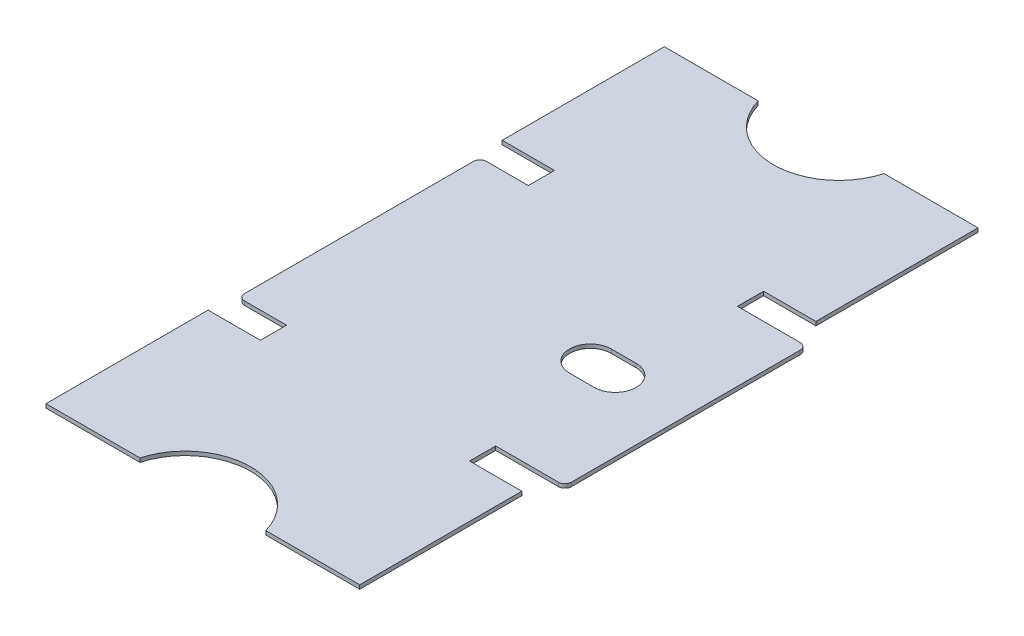
from build123d import *

# Parameters (mm, degrees)
EXTRUDE_1_DEPTH = 0.3


with BuildPart() as part:
    # Эскиз1 → Бобышка-Вытянуть1 (new body)
    with BuildSketch(Plane(origin=(0, 0, 0), x_dir=(1, 0, 0), z_dir=(0, 1, 0))):
        with BuildLine():
            Line((-11.404541059, 16.350155755), (-11.404541059, 28.750155755))
            Line((-11.404541059, 28.750155755), (-18.590239448, 28.750155755))
            ThreePointArc((-18.590239448, 28.750155755), (-23.404541059, 25.100155755), (-28.218842669, 28.750155755))
            Line((-28.218842669, 28.750155755), (-35.404541059, 28.750155755))
            Line((-35.404541059, 28.750155755), (-35.404541059, 16.350155755))
            Line((-35.404541059, 16.350155755), (-31.404541059, 16.350155755))
            Line((-31.404541059, 16.350155755), (-31.404541059, 14.350155755))
            Line((-31.404541059, 14.350155755), (-34.604541059, 14.350155755))
            ThreePointArc((-34.604541059, 14.350155755), (-34.958094449, 14.203709145), (-35.104541059, 13.850155755))
            Line((-35.104541059, 13.850155755), (-35.104541059, -3.649844245))
            ThreePointArc((-35.104541059, -3.649844245), (-34.958094449, -4.003397636), (-34.604541059, -4.149844245))
            Line((-34.604541059, -4.149844245), (-31.404541059, -4.149844245))
            Line((-31.404541059, -4.149844245), (-31.404541059, -6.149844245))
            Line((-31.404541059, -6.149844245), (-35.404541059, -6.149844245))
            Line((-35.404541059, -6.149844245), (-35.404541059, -18.549844245))
            Line((-35.404541059, -18.549844245), (-28.218842669, -18.549844245))
            ThreePointArc((-28.218842669, -18.549844245), (-23.404541059, -14.899844245), (-18.590239448, -18.549844245))
            Line((-18.590239448, -18.549844245), (-11.404541059, -18.549844245))
            Line((-11.404541059, -18.549844245), (-11.404541059, -6.149844245))
            Line((-11.404541059, -6.149844245), (-15.404541059, -6.149844245))
            Line((-15.404541059, -6.149844245), (-15.404541059, -4.149844245))
            Line((-15.404541059, -4.149844245), (-10.604541059, -4.149844245))
            ThreePointArc((-10.604541059, -4.149844245), (-10.250987668, -4.003397636), (-10.104541059, -3.649844245))
            Line((-10.104541059, -3.649844245), (-10.104541059, 13.850155755))
            ThreePointArc((-10.104541059, 13.850155755), (-10.250987668, 14.203709145), (-10.604541059, 14.350155755))
            Line((-10.604541059, 14.350155755), (-15.404541059, 14.350155755))
            Line((-15.404541059, 14.350155755), (-15.404541059, 16.350155755))
            Line((-15.404541059, 16.350155755), (-11.404541059, 16.350155755))
        make_face()
        with BuildLine():
            Line((-17.404541059, 6.700155755), (-15.504541059, 6.700155755))
            ThreePointArc((-15.504541059, 6.700155755), (-13.904541059, 5.100155755), (-15.504541059, 3.500155755))
            Line((-15.504541059, 3.500155755), (-17.404541059, 3.500155755))
            ThreePointArc((-17.404541059, 3.500155755), (-19.004541059, 5.100155755), (-17.404541059, 6.700155755))
        make_face(mode=Mode.SUBTRACT)
    extrude(amount=EXTRUDE_1_DEPTH)


solid = part.part
